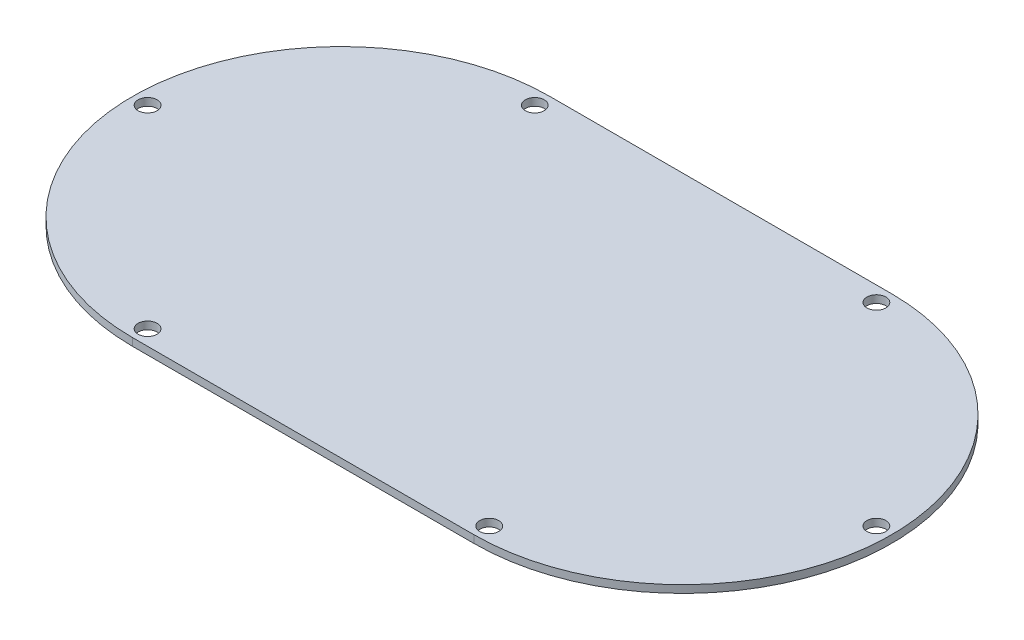
from build123d import *

# Parameters (mm, degrees)
SKETCH_1_R      = 2.5
EXTRUDE_1_DEPTH = 2


with BuildPart() as part:
    # 草图1 → 凸台-拉伸1 (new body)
    with BuildSketch(Plane(origin=(0, 0, 0), x_dir=(1, 0, 0), z_dir=(0, 1, 0))):
        with BuildLine():
            Line((-45, 55), (45, 55))
            ThreePointArc((45, 55), (100, 0), (45, -55))
            Line((45, -55), (-45, -55))
            ThreePointArc((-45, -55), (-100, 0), (-45, 55))
        make_face()
        with Locations(Location((-45, 51, 0), (0, 0, 270))):
            Circle(SKETCH_1_R, mode=Mode.SUBTRACT)
        with Locations(Location((-96, 0, 0), (0, 0, 270))):
            Circle(SKETCH_1_R, mode=Mode.SUBTRACT)
        with Locations(Location((-45, -51, 0), (0, 0, 270))):
            Circle(SKETCH_1_R, mode=Mode.SUBTRACT)
        with Locations(Location((45, -51, 0), (0, 0, 90))):
            Circle(SKETCH_1_R, mode=Mode.SUBTRACT)
        with Locations(Location((96, 0, 0), (0, 0, 90))):
            Circle(SKETCH_1_R, mode=Mode.SUBTRACT)
        with Locations(Location((45, 51, 0), (0, 0, 90))):
            Circle(SKETCH_1_R, mode=Mode.SUBTRACT)
    extrude(amount=EXTRUDE_1_DEPTH)


solid = part.part
